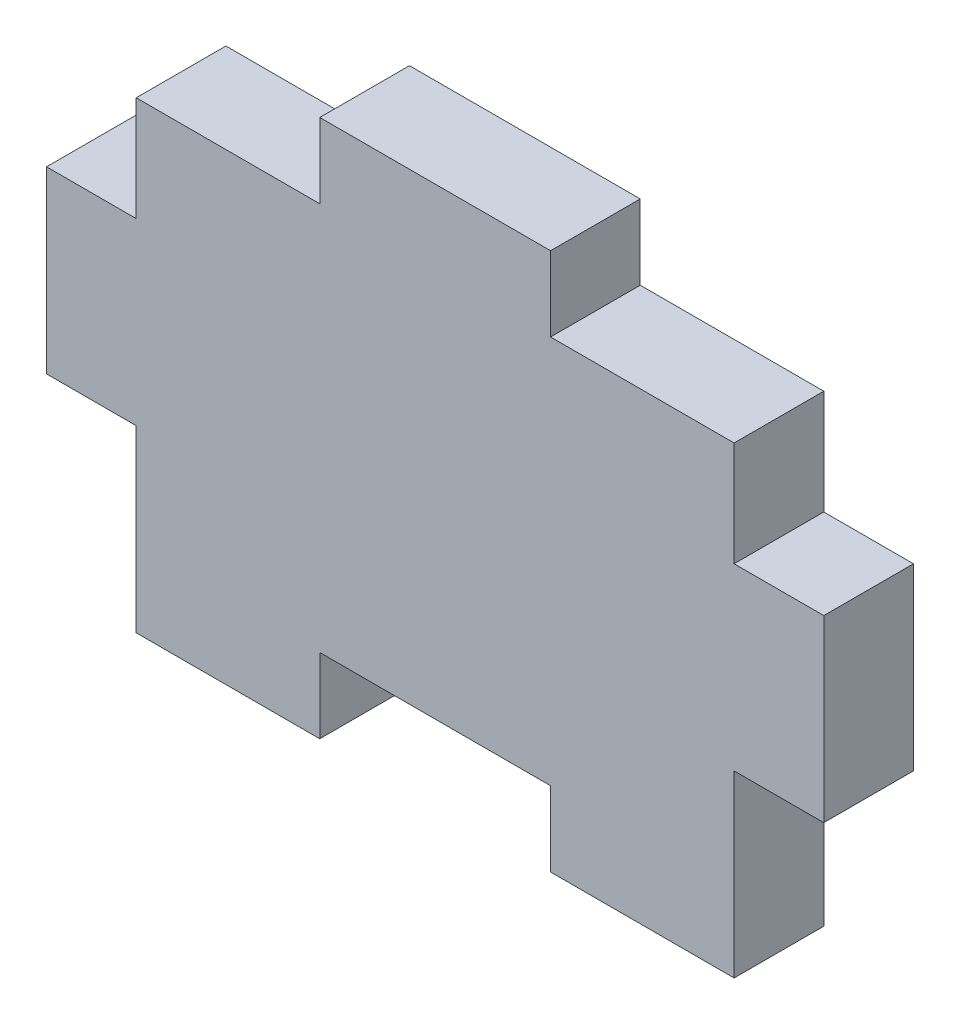
from build123d import *

# Parameters (mm, degrees)
BOSS_EXTRUDE4_DEPTH = 3


with BuildPart() as part:
    # Sketch1 → Boss-Extrude4 (new body)
    with BuildSketch(Plane.XY):
        Polygon((3.860190234, -0.618906454), (10, -0.618906454), (10, 5.381093546), (13, 5.381093546), (13, 11.381093546), (10, 11.381093546), (10, 14.881093546), (3.860190234, 14.881093546), (3.860190234, 17.381093546), (-3.860190234, 17.381093546), (-3.860190234, 14.881093546), (-10, 14.881093546), (-10, 11.381093546), (-13, 11.381093546), (-13, 5.381093546), (-10, 5.381093546), (-10, -0.618906454), (-3.860190234, -0.618906454), (-3.860190234, 1.881093546), (3.860190234, 1.881093546), align=None)
    extrude(amount=BOSS_EXTRUDE4_DEPTH)


solid = part.part
